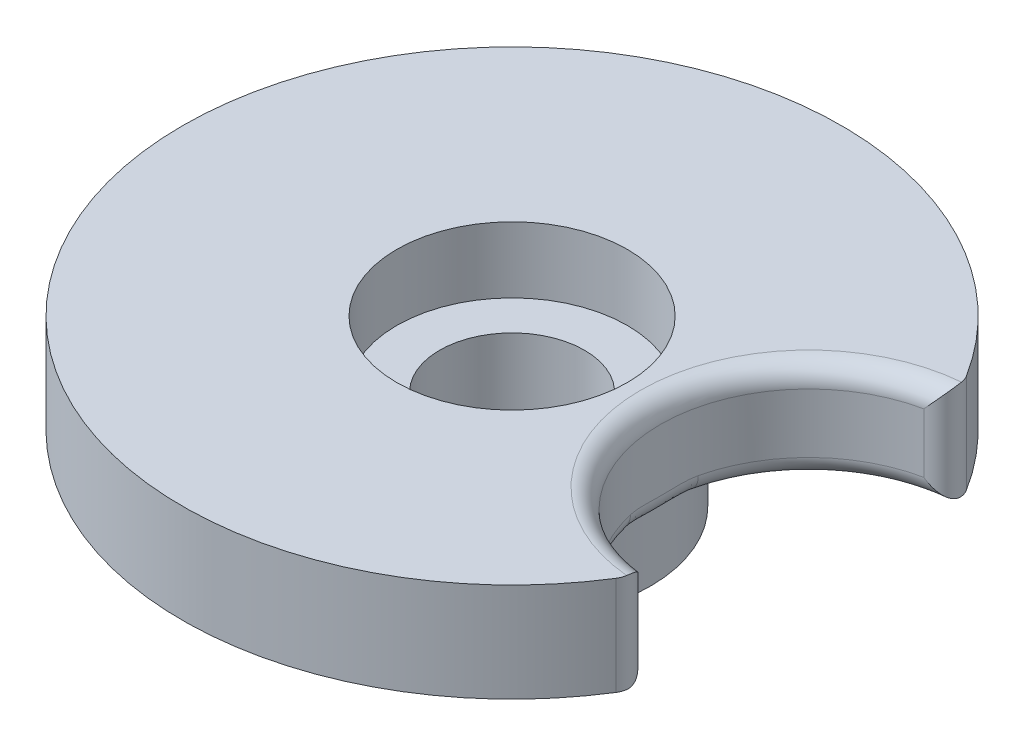
from build123d import *

# Parameters (mm, degrees)
SKETCH1_R           = 2.794
BOSS_EXTRUDE1_DEPTH = 3.81
SKETCH3_R           = 4.445
CUT_EXTRUDE1_DEPTH  = 2.54
BOSS_EXTRUDE2_START = 2.54
SKETCH4_R           = 5.334
SKETCH4_R_2         = 2.794
BOSS_EXTRUDE2_DEPTH = 2.54
FILLET2_R           = 0.762


with BuildPart() as part:
    # Sketch1 → Boss-Extrude1 (new body)
    with BuildSketch(Plane(origin=(0, 0, 0), x_dir=(1, 0, 0), z_dir=(0, 1, 0))):
        with BuildLine():
            ThreePointArc((11.341805556, 5.714319447), (5.715, 0), (11.341805556, -5.714319447))
            ThreePointArc((11.341805556, -5.714319447), (-12.7, 0), (11.341805556, 5.714319447))
        make_face()
        with Locations(Location((0, 0, 0), (0, 0, 90))):
            Circle(SKETCH1_R, mode=Mode.SUBTRACT)
    extrude(amount=BOSS_EXTRUDE1_DEPTH)

    # Sketch3 → Cut-Extrude1 (cut)
    with BuildSketch(Plane(origin=(0, 3.81, 0), x_dir=(1, 0, 0), z_dir=(0, 1, 0))):
        with Locations(Location((0, 0, 0), (0, 0, 270))):
            Circle(SKETCH3_R)
    extrude(amount=-CUT_EXTRUDE1_DEPTH, mode=Mode.SUBTRACT)

    # Sketch4 → Boss-Extrude2 (add)
    with BuildSketch(Plane.XZ.offset(BOSS_EXTRUDE2_START)):
        with Locations(Location((0, 0, 0), (0, 0, 90))):
            Circle(SKETCH4_R)
        with Locations(Location((0, 0, 0), (0, 0, 270))):
            Circle(SKETCH4_R_2, mode=Mode.SUBTRACT)
    extrude(amount=-BOSS_EXTRUDE2_DEPTH)

    # Fillet2
    fillet2_edges = [part.edges().sort_by_distance(p)[0] for p in [
        (5.715, 3.81, 0),
        (5.715, 0, 0),
        (11.341805556, 1.905, 5.714319447),
        (11.341805556, 1.905, -5.714319447),
    ]]
    fillet(fillet2_edges, radius=FILLET2_R)


solid = part.part
